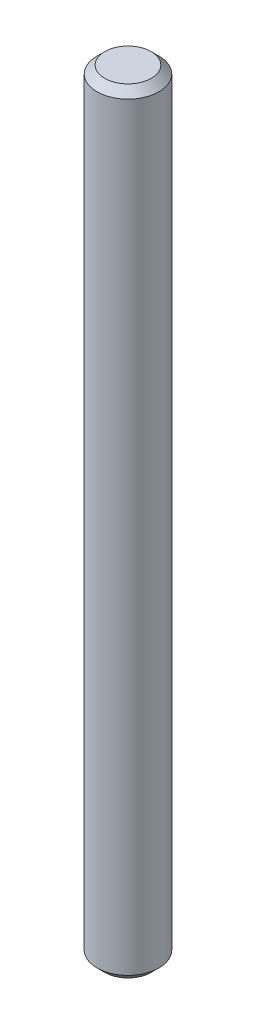
from build123d import *

# Parameters (mm, degrees)
SKETCH1_R           = 4
BOSS_EXTRUDE1_DEPTH = 100
CHAMFER1_SIZE       = 1


with BuildPart() as part:
    # Sketch1 → Boss-Extrude1 (new body)
    with BuildSketch(Plane(origin=(0, 0, 0), x_dir=(1, 0, 0), z_dir=(0, 1, 0))):
        with Locations(Location((0, 0, 0), (0, 0, 270))):
            Circle(SKETCH1_R)
    extrude(amount=BOSS_EXTRUDE1_DEPTH)

    # Chamfer1
    chamfer1_edges = [part.edges().sort_by_distance(p)[0] for p in [
        (0, 0, -4),
        (0, 100, -4),
    ]]
    chamfer(chamfer1_edges, length=CHAMFER1_SIZE)


solid = part.part
